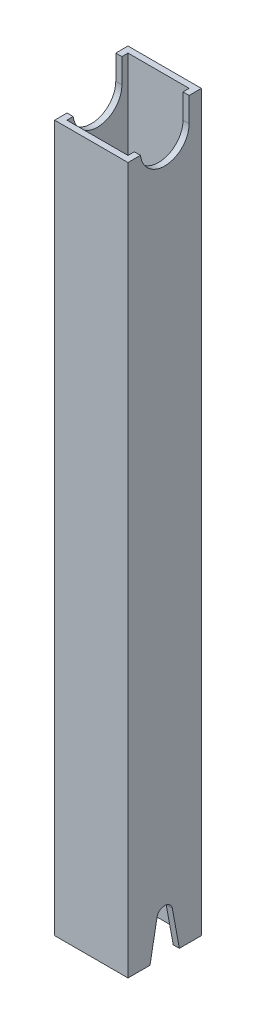
from build123d import *

# Parameters (mm, degrees)
SKETCH1_W                   = 30
SKETCH1_H                   = 30
SKETCH1_W_2                 = 25
SKETCH1_H_2                 = 25
BOSS_EXTRUDE1_DEPTH         = 300
F_1_4_0_25_DIAMETER_HOLE1_D = 6.35
CUT_EXTRUDE1_DEPTH          = 302.869176962
CUT_EXTRUDE2_DEPTH          = 302.869176962


with BuildPart() as part:
    # Sketch1 → Boss-Extrude1 (new body)
    with BuildSketch(Plane(origin=(0, 0, 0), x_dir=(1, 0, 0), z_dir=(0, 1, 0))):
        Rectangle(SKETCH1_W, SKETCH1_H)
        Rectangle(SKETCH1_W_2, SKETCH1_H_2, mode=Mode.SUBTRACT)
    extrude(amount=BOSS_EXTRUDE1_DEPTH)

    # 1/4 (0.25) Diameter Hole1 (through all)
    with Locations(Plane.ZY.offset(15)):
        with Locations((0, 15)):
            Hole(F_1_4_0_25_DIAMETER_HOLE1_D / 2)

    # Sketch4 → Cut-Extrude1 (cut, through all)
    with BuildSketch(Plane.ZY.offset(15)):
        with BuildLine():
            Line((-10, 300), (-10, 290))
            ThreePointArc((-10, 290), (-0.626229125, 280.019627408), (9.921567416, 288.75))
            Line((9.921567416, 288.75), (15, 288.75))
            Line((15, 288.75), (15, 300))
            Line((15, 300), (-10, 300))
        make_face()
    extrude(amount=-CUT_EXTRUDE1_DEPTH, mode=Mode.SUBTRACT)

    # Sketch5 → Cut-Extrude2 (cut, through all)
    with BuildSketch(Plane.ZY.offset(15)):
        with BuildLine():
            Line((-3.122162674, 15.576823403), (-6, 0))
            Line((-6, 0), (6, 0))
            Line((6, 0), (3.122162674, 15.576823403))
            ThreePointArc((3.122162674, 15.576823403), (0, 18.175), (-3.122162674, 15.576823403))
        make_face()
    extrude(amount=-CUT_EXTRUDE2_DEPTH, mode=Mode.SUBTRACT)


solid = part.part
